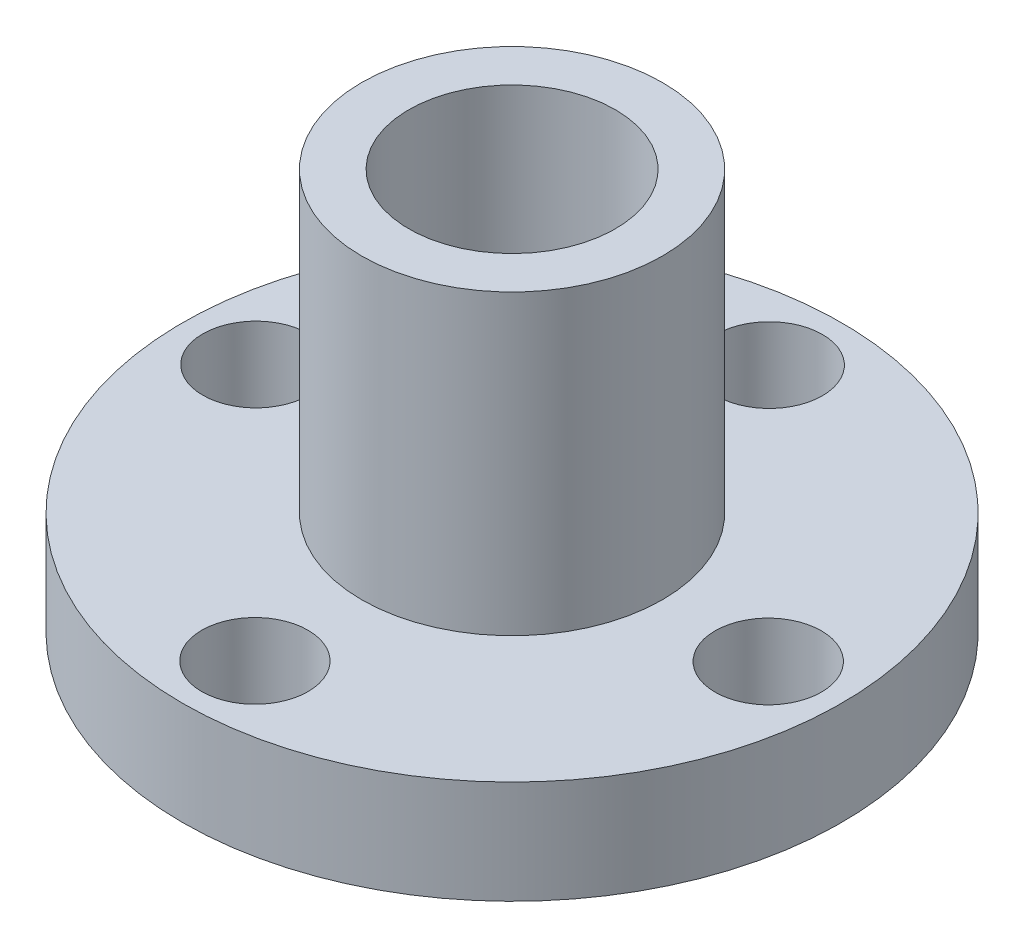
from build123d import *

# Parameters (mm, degrees)
SKETCH1_R                   = 5
BOSS_EXTRUDE1_DEPTH         = 1.5
SKETCH2_R                   = 10.85
BOSS_EXTRUDE2_DEPTH         = 3.4
SKETCH3_R                   = 4.95
BOSS_EXTRUDE3_DEPTH         = 9.8
M8_TAPPED_HOLE1_D           = 6.8
M8_TAPPED_HOLE1_CSINK_D     = 8.05
M8_TAPPED_HOLE1_CSINK_ANGLE = 90
SKETCH6_R                   = 1.75
CUT_EXTRUDE1_DEPTH          = 21.240676866


with BuildPart() as part:
    # Sketch1 → Boss-Extrude1 (new body)
    with BuildSketch(Plane(origin=(0, 0, 0), x_dir=(1, 0, 0), z_dir=(0, 1, 0))):
        with Locations(Location((0, 0, 0), (0, 0, 270))):
            Circle(SKETCH1_R)
    extrude(amount=BOSS_EXTRUDE1_DEPTH)

    # Sketch2 → Boss-Extrude2 (add)
    with BuildSketch(Plane(origin=(0, 1.5, 0), x_dir=(1, 0, 0), z_dir=(0, 1, 0))):
        with Locations(Location((0, 0, 0), (0, 0, 270))):
            Circle(SKETCH2_R)
    extrude(amount=BOSS_EXTRUDE2_DEPTH)

    # Sketch3 → Boss-Extrude3 (add)
    with BuildSketch(Plane(origin=(0, 4.9, 0), x_dir=(1, 0, 0), z_dir=(0, 1, 0))):
        with Locations(Location((0, 0, 0), (0, 0, 270))):
            Circle(SKETCH3_R)
    extrude(amount=BOSS_EXTRUDE3_DEPTH)

    # M8 Tapped Hole1 (through all)
    with Locations(Plane(origin=(0, 0, 0), x_dir=(0, 0, -1), z_dir=(0, -1, 0))):
        with Locations((0, 0)):
            CounterSinkHole(M8_TAPPED_HOLE1_D / 2, M8_TAPPED_HOLE1_CSINK_D / 2, counter_sink_angle=M8_TAPPED_HOLE1_CSINK_ANGLE)

    # Sketch6 → Cut-Extrude1 (cut, through all)
    with BuildSketch(Plane.XZ.offset(-1.5)):
        with Locations(Location((-0.016416422, 8.449812512, 0), (0, 0, 270))):
            Circle(SKETCH6_R)
        with Locations(Location((8.449812512, 0.016416422, 0), (0, 0, 270))):
            Circle(SKETCH6_R)
        with Locations(Location((0.016416422, -8.449812512, 0), (0, 0, 270))):
            Circle(SKETCH6_R)
        with Locations(Location((-8.449812512, -0.016416422, 0), (0, 0, 270))):
            Circle(SKETCH6_R)
    extrude(amount=-CUT_EXTRUDE1_DEPTH, mode=Mode.SUBTRACT)


solid = part.part
